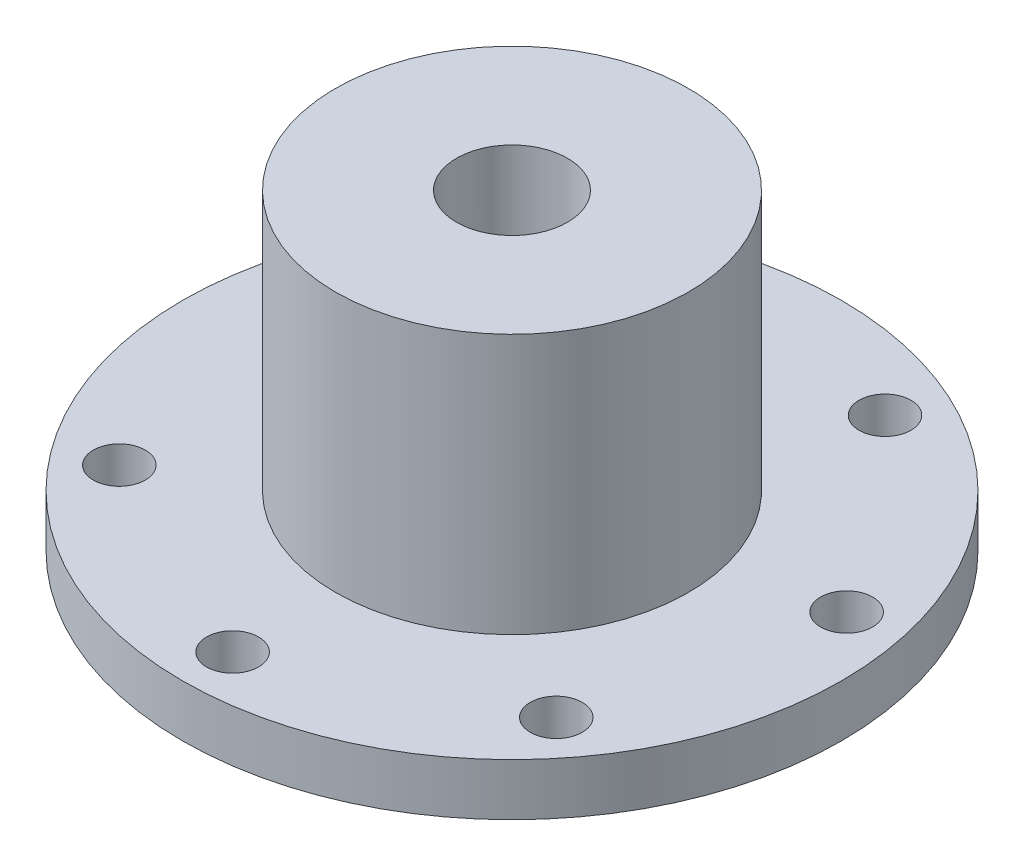
from build123d import *

# Parameters (mm, degrees)
BOSS_EXTRUDE1_DEPTH      = 15
BOSS_EXTRUDE1_DEPTH_BACK = 3
SKETCH1_R                = 10.175
SKETCH1_R_2              = 3.2
SKETCH1_3_R              = 19
SKETCH1_3_R_2            = 10.175
BOSS_EXTRUDE2_DEPTH      = 3
SKETCH2_R                = 1.25
CUT_EXTRUDE1_DEPTH       = 15
SKETCH4_R                = 4.5
BOSS_EXTRUDE3_DEPTH      = 10
SKETCH1_7_R              = 3.2
CUT_EXTRUDE2_DEPTH       = 13
SKETCH3_R                = 1.5
CUT_EXTRUDE3_DEPTH       = 10


with BuildPart() as part:
    # Sketch1 → Boss-Extrude1 (new, two sides: drawn at the far end of the back side and taken through both)
    with BuildSketch(Plane(origin=(0, 0, 0), x_dir=(1, 0, 0), z_dir=(0, 1, 0)).offset(-BOSS_EXTRUDE1_DEPTH_BACK)):
        Circle(SKETCH1_R)
        Circle(SKETCH1_R_2, mode=Mode.SUBTRACT)
    extrude(amount=BOSS_EXTRUDE1_DEPTH + BOSS_EXTRUDE1_DEPTH_BACK)

    # Sketch2 → Cut-Extrude1 (cut)
    with BuildSketch(Plane(origin=(0, 0, 0), x_dir=(0, 0, -1), z_dir=(1, 0, 0))):
        with Locations((0, 6.702870317)):
            Circle(SKETCH2_R)
    extrude(amount=-CUT_EXTRUDE1_DEPTH, mode=Mode.SUBTRACT)


with BuildPart() as body_2:
    # Sketch1<3> → Boss-Extrude2 (new body)
    with BuildSketch(Plane(origin=(0, 0, 0), x_dir=(1, 0, 0), z_dir=(0, 1, 0))):
        Circle(SKETCH1_3_R)
        Circle(SKETCH1_3_R_2, mode=Mode.SUBTRACT)
    extrude(amount=-BOSS_EXTRUDE2_DEPTH)


    add(part.part)  # Boss-Extrude3 merges part
    # Sketch4 → Boss-Extrude3 (add)
    with BuildSketch(Plane.XZ.offset(3)):
        Circle(SKETCH4_R)
    extrude(amount=BOSS_EXTRUDE3_DEPTH)

    # Sketch1<7> → Cut-Extrude2 (cut)
    with BuildSketch(Plane(origin=(0, 0, 0), x_dir=(1, 0, 0), z_dir=(0, 1, 0))):
        Circle(SKETCH1_7_R)
    extrude(amount=-CUT_EXTRUDE2_DEPTH, mode=Mode.SUBTRACT)

    # Sketch3 → Cut-Extrude3 (cut)
    with BuildSketch(Plane.XZ.offset(3)):
        with Locations((0, 16.112537947)):
            Circle(SKETCH3_R)
        with Locations((12.597289429, 10.046003092)):
            Circle(SKETCH3_R)
        with Locations((15.70856298, -3.585376992)):
            Circle(SKETCH3_R)
        with Locations((6.990968211, -14.516895073)):
            Circle(SKETCH3_R)
        with Locations((-6.990968211, -14.516895073)):
            Circle(SKETCH3_R)
        with Locations((-15.70856298, -3.585376992)):
            Circle(SKETCH3_R)
        with Locations((-12.597289429, 10.046003092)):
            Circle(SKETCH3_R)
    extrude(amount=-CUT_EXTRUDE3_DEPTH, mode=Mode.SUBTRACT)


solid = body_2.part
